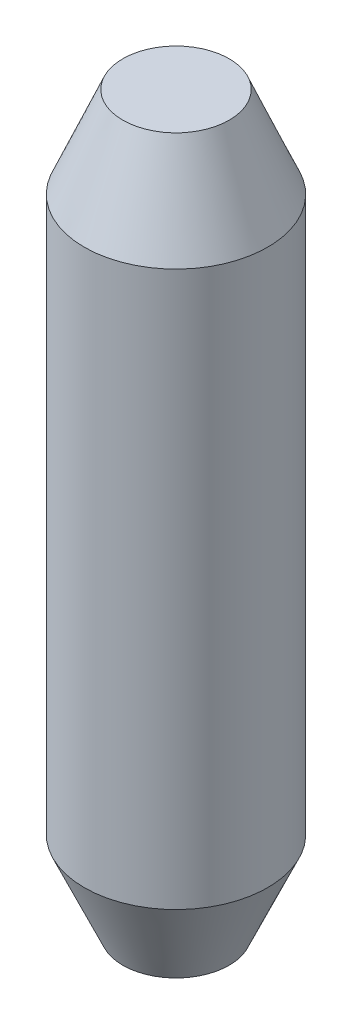
from build123d import *

# Parameters (mm, degrees)
SKETCH1_R           = 2.38125
BOSS_EXTRUDE1_DEPTH = 19
CHAMFER1_SIZE       = 1
CHAMFER1_SIZE2      = 2.246036774
CHAMFER2_SIZE       = 1
CHAMFER2_SIZE2      = 2.355852366


with BuildPart() as part:
    # Sketch1 → Boss-Extrude1 (new body)
    with BuildSketch(Plane(origin=(0, 0, 0), x_dir=(1, 0, 0), z_dir=(0, 1, 0))):
        with Locations(Location((0, 0, 0), (0, 0, 270))):
            Circle(SKETCH1_R)
    extrude(amount=BOSS_EXTRUDE1_DEPTH)

    # Chamfer1
    chamfer1_edges = [part.edges().sort_by_distance(p)[0] for p in [
        (0, 0, -2.38125),
    ]]
    chamfer1_side = [part.faces().sort_by_distance(p)[0] for p in [
        (0, 0, 0),
    ]]
    chamfer(chamfer1_edges, length=CHAMFER1_SIZE, length2=CHAMFER1_SIZE2, reference=chamfer1_side[0])

    # Chamfer2
    chamfer2_edges = [part.edges().sort_by_distance(p)[0] for p in [
        (0, 19, -2.38125),
    ]]
    chamfer2_side = [part.faces().sort_by_distance(p)[0] for p in [
        (0, 19, 0),
    ]]
    chamfer(chamfer2_edges, length=CHAMFER2_SIZE, length2=CHAMFER2_SIZE2, reference=chamfer2_side[0])


solid = part.part
